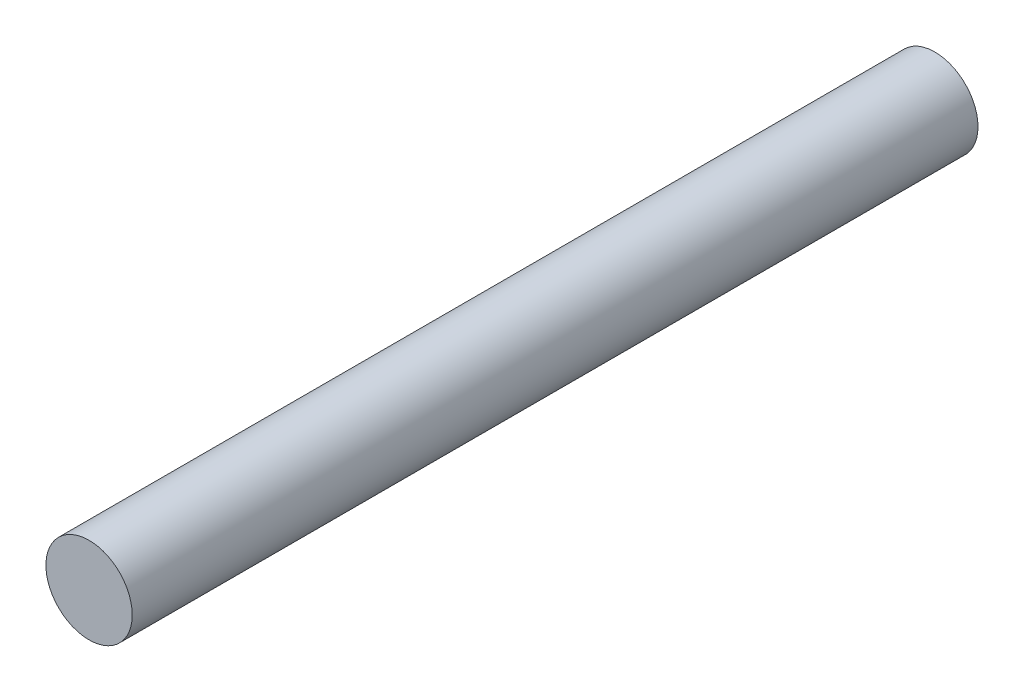
from build123d import *

# Parameters (mm, degrees)
SKETCH_1_R      = 5
EXTRUDE_1_DEPTH = 98


with BuildPart() as part:
    # 草图1 → 凸台-拉伸1 (new body)
    with BuildSketch(Plane.XY):
        Circle(SKETCH_1_R)
    extrude(amount=EXTRUDE_1_DEPTH)


solid = part.part
